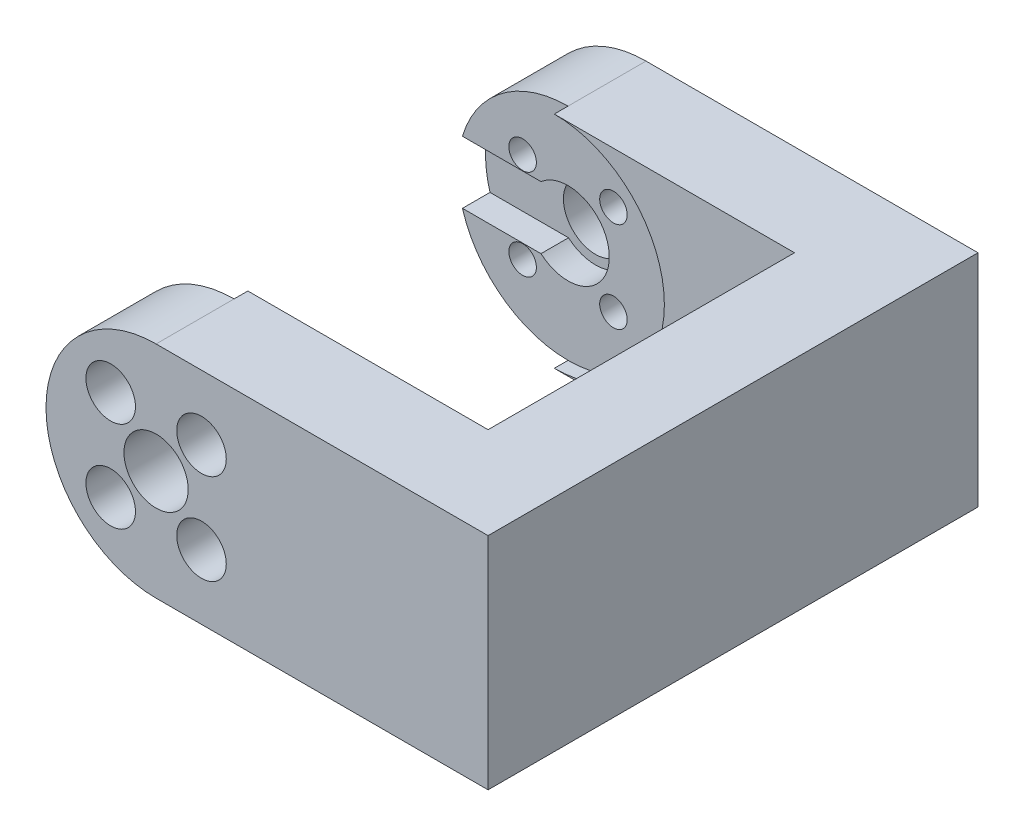
from build123d import *

# Parameters (mm, degrees)
EXTRUDE_1_DEPTH      = 13.5
SKETCH_5_R           = 10.1
CUT_EXTRUDE_2_DEPTH  = 1.5
SKETCH_7_R           = 3.5
CUT_EXTRUDE_3_DEPTH  = 37
SKETCH_21_R          = 4.5
CUT_EXTRUDE_12_DEPTH = 3
SKETCH_9_R           = 1.5
CUT_EXTRUDE_4_DEPTH  = 24.5
SKETCH_11_W          = 60.4
SKETCH_11_H          = 24
EXTRUDE_2_DEPTH      = 10
SKETCH_12_R          = 2.7
CUT_EXTRUDE_5_DEPTH  = 8.5
SKETCH_18_R          = 12
CUT_EXTRUDE_9_DEPTH  = 1.5
SKETCH_19_W          = 16.628747166
SKETCH_19_H          = 6.8
CUT_EXTRUDE_10_DEPTH = 3
SKETCH_20_W          = 76.507524202
SKETCH_20_H          = 37.102074034
CUT_EXTRUDE_11_DEPTH = 3.5


with BuildPart() as part:
    # 草图1 → 凸台-拉伸1 (new body)
    with BuildSketch(Plane.XY):
        with BuildLine():
            Line((0, 12), (36.185307738, 12))
            Line((36.185307738, 12), (36.185307738, -12))
            Line((36.185307738, -12), (0, -12))
            ThreePointArc((0, -12), (-12, 0), (0, 12))
        make_face()
    extrude(amount=EXTRUDE_1_DEPTH)

    # 草图5 → 切除-拉伸2 (cut)
    with BuildSketch(Plane(origin=(0, 0, 0), x_dir=(-1, 0, 0), z_dir=(0, 0, -1))):
        Circle(SKETCH_5_R)
    extrude(amount=-CUT_EXTRUDE_2_DEPTH, mode=Mode.SUBTRACT)

    # 草图7 → 切除-拉伸3 (cut)
    with BuildSketch(Plane(origin=(0, 0, 1.5), x_dir=(-1, 0, 0), z_dir=(0, 0, -1))):
        Circle(SKETCH_7_R)
    extrude(amount=-CUT_EXTRUDE_3_DEPTH, mode=Mode.SUBTRACT)

    # 草图21 → 切除-拉伸12 (cut)
    with BuildSketch(Plane(origin=(0, 0, 1.5), x_dir=(-1, 0, 0), z_dir=(0, 0, -1))):
        Circle(SKETCH_21_R)
    extrude(amount=-CUT_EXTRUDE_12_DEPTH, mode=Mode.SUBTRACT)

    # 草图9 → 切除-拉伸4 (cut)
    with BuildSketch(Plane(origin=(0, 0, 1.5), x_dir=(-1, 0, 0), z_dir=(0, 0, -1))):
        with Locations((-4.949747468, 4.949747468)):
            Circle(SKETCH_9_R)
        with Locations((4.949747468, 4.949747468)):
            Circle(SKETCH_9_R)
        with Locations((4.949747468, -4.949747468)):
            Circle(SKETCH_9_R)
        with Locations((-4.949747468, -4.949747468)):
            Circle(SKETCH_9_R)
    extrude(amount=-CUT_EXTRUDE_4_DEPTH, mode=Mode.SUBTRACT)


with BuildPart() as body_2:
    # 镜向14: mirrored copy
    add(part.part.mirror(Plane(origin=(0, 0, -16.7), x_dir=(1, 0, 0), z_dir=(0, 0, -1))))


with BuildPart() as part_1:
    add(part.part)

    add(body_2.part)  # 凸台-拉伸2 merges body 2
    # 草图11 → 凸台-拉伸2 (add)
    with BuildSketch(Plane(origin=(36.185307738, 0, 0), x_dir=(0, 0, -1), z_dir=(1, 0, 0))):
        with Locations((16.7, 0)):
            Rectangle(SKETCH_11_W, SKETCH_11_H)
    extrude(amount=-EXTRUDE_2_DEPTH)

    # 草图12 → 切除-拉伸5 (cut)
    with BuildSketch(Plane.XY.offset(13.5)):
        with Locations((4.949747468, 4.949747468)):
            Circle(SKETCH_12_R)
        with Locations((4.949747468, -4.949747468)):
            Circle(SKETCH_12_R)
        with Locations((-4.949747468, -4.949747468)):
            Circle(SKETCH_12_R)
        with Locations((-4.949747468, 4.949747468)):
            Circle(SKETCH_12_R)
    cut_extrude_5 = extrude(amount=-CUT_EXTRUDE_5_DEPTH, mode=Mode.SUBTRACT)

    # 草图18 → 切除-拉伸9 (cut)
    with BuildSketch(Plane(origin=(0, 0, 0), x_dir=(-1, 0, 0), z_dir=(0, 0, -1))):
        Circle(SKETCH_18_R)
    cut_extrude_9 = extrude(amount=-CUT_EXTRUDE_9_DEPTH, mode=Mode.SUBTRACT)

    # 草图19 → 切除-拉伸10 (cut)
    with BuildSketch(Plane(origin=(0, 0, 1.5), x_dir=(-1, 0, 0), z_dir=(0, 0, -1))):
        with Locations((8.314373583, 0)):
            Rectangle(SKETCH_19_W, SKETCH_19_H)
    cut_extrude_10 = extrude(amount=-CUT_EXTRUDE_10_DEPTH, mode=Mode.SUBTRACT)

    # 草图20 → 切除-拉伸11 (cut)
    with BuildSketch(Plane.XY.offset(13.5)):
        with Locations((20.283666709, 0.248055891)):
            Rectangle(SKETCH_20_W, SKETCH_20_H)
    cut_extrude_11 = extrude(amount=-CUT_EXTRUDE_11_DEPTH, mode=Mode.SUBTRACT)

    # 镜向24: 切除-拉伸5, 切除-拉伸9, 切除-拉伸10 across plane
    add(cut_extrude_5.mirror(Plane(origin=(0, 0, -16.7), x_dir=(1, 0, 0), z_dir=(0, 0, -1))), mode=Mode.SUBTRACT)
    add(cut_extrude_9.mirror(Plane(origin=(0, 0, -16.7), x_dir=(1, 0, 0), z_dir=(0, 0, -1))), mode=Mode.SUBTRACT)
    add(cut_extrude_10.mirror(Plane(origin=(0, 0, -16.7), x_dir=(1, 0, 0), z_dir=(0, 0, -1))), mode=Mode.SUBTRACT)

    # 镜向26: 切除-拉伸11 across plane
    add(cut_extrude_11.mirror(Plane(origin=(0, 0, -16.7), x_dir=(1, 0, 0), z_dir=(0, 0, -1))), mode=Mode.SUBTRACT)


solid = part_1.part
